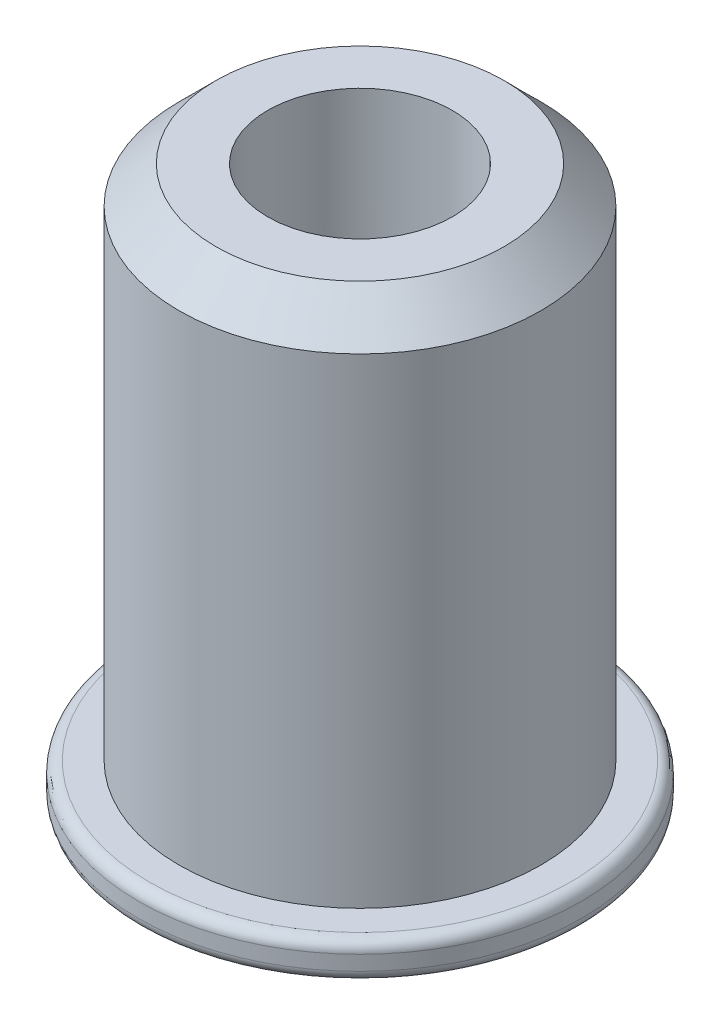
from build123d import *

# Parameters (mm, degrees)
ESBO_O1_R                     = 3
EXTRUS_O1_DEPTH               = 0.5
ESBO_O2_R                     = 2.45
EXTRUS_O2_DEPTH               = 7
CHANFRO1_SIZE                 = 0.5
ESBO_O3_R                     = 1.95
EXTRUS_O3_DEPTH               = 2
ESBO_O4_R                     = 1.05
EXTRUS_O4_DEPTH               = 10
FURO_ROSCADO_DE_M3X0_53_D     = 2.5
FURO_ROSCADO_DE_M3X0_53_DEPTH = 8.5
FURO_ROSCADO_DE_M3X0_53_TIP   = 0.751075774
FILETE1_R                     = 0.15


with BuildPart() as part:
    # Esboço1 → Extrusão1 (new body)
    with BuildSketch(Plane(origin=(0, 0, 0), x_dir=(1, 0, 0), z_dir=(0, 1, 0))):
        with Locations(Location((-26.751205923, -11.338633094, 0), (0, 0, 270))):
            Circle(ESBO_O1_R)
    extrude(amount=EXTRUS_O1_DEPTH)

    # Esboço2 → Extrusão2 (add)
    with BuildSketch(Plane(origin=(0, 0.5, 0), x_dir=(1, 0, 0), z_dir=(0, 1, 0))):
        with Locations(Location((-26.751205923, -11.338633094, 0), (0, 0, 270))):
            Circle(ESBO_O2_R)
    extrude(amount=EXTRUS_O2_DEPTH)

    # Chanfro1
    chanfro1_edges = [part.edges().sort_by_distance(p)[0] for p in [
        (-26.751205923, 7.5, 8.888633094),
    ]]
    chamfer(chanfro1_edges, length=CHANFRO1_SIZE)

    # Esboço3 → Extrusão3 (cut)
    with BuildSketch(Plane.XZ):
        with Locations(Location((-26.751205923, 11.338633094, 0), (0, 0, 270))):
            Circle(ESBO_O3_R)
    extrude(amount=-EXTRUS_O3_DEPTH, mode=Mode.SUBTRACT)

    # Esboço4 → Extrusão4 (cut)
    with BuildSketch(Plane(origin=(0, 7.5, 0), x_dir=(1, 0, 0), z_dir=(0, 1, 0))):
        with Locations(Location((-26.751205923, -11.338633094, 0), (0, 0, 270))):
            Circle(ESBO_O4_R)
    extrude(amount=-EXTRUS_O4_DEPTH, mode=Mode.SUBTRACT)

    # Furo roscado de M3x0.53
    with Locations(Plane(origin=(-26.751205923, 7.5, 11.338633094), x_dir=(0, 0, 1), z_dir=(0, 1, 0))):
        with Locations((0, 0)):
            Hole(FURO_ROSCADO_DE_M3X0_53_D / 2, depth=FURO_ROSCADO_DE_M3X0_53_DEPTH)
            with Locations((0, 0, -(FURO_ROSCADO_DE_M3X0_53_DEPTH + FURO_ROSCADO_DE_M3X0_53_TIP / 2))):  # 118° drill point
                Cone(0, FURO_ROSCADO_DE_M3X0_53_D / 2, FURO_ROSCADO_DE_M3X0_53_TIP, mode=Mode.SUBTRACT)

    # Filete1
    filete1_edges = [part.edges().sort_by_distance(p)[0] for p in [
        (-26.751205923, 0, 13.288633094),
        (-26.751205923, 0, 8.338633094),
        (-26.751205923, 0.5, 8.338633094),
    ]]
    fillet(filete1_edges, radius=FILETE1_R)


solid = part.part
